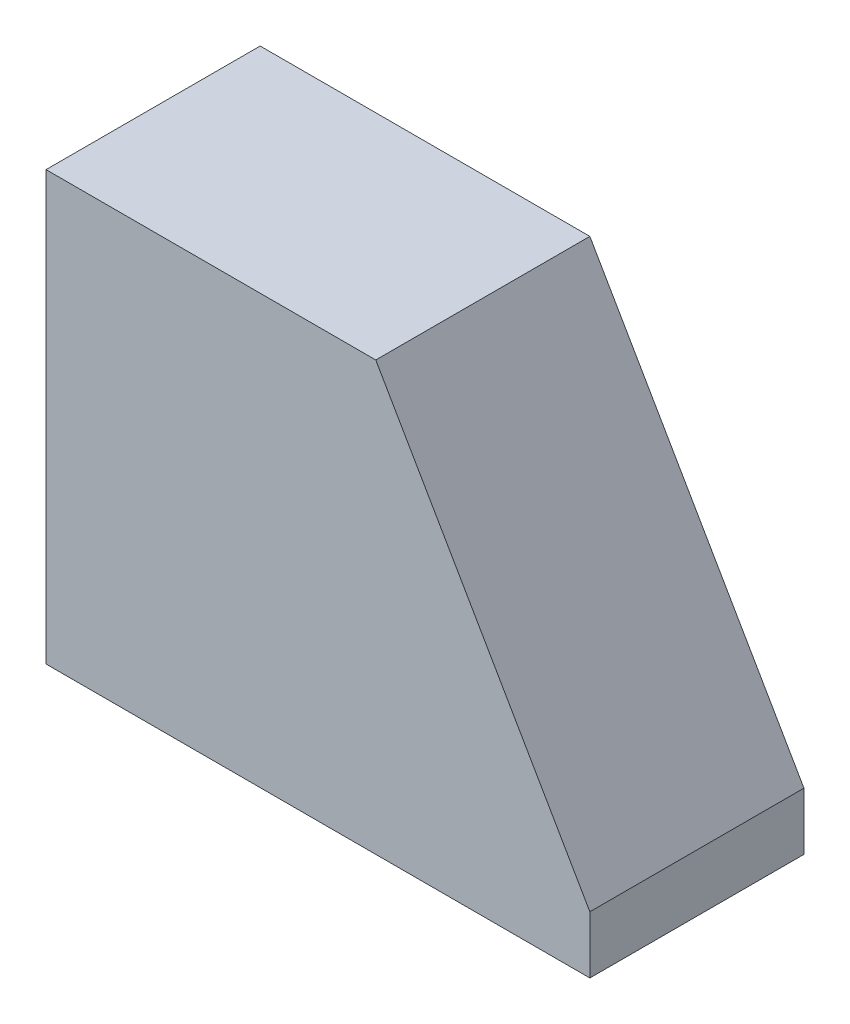
from build123d import *

# Parameters (mm, degrees)
SKETCH1_W           = 10
SKETCH1_H           = 20
BOSS_EXTRUDE1_DEPTH = 25.4
CHAMFER1_SIZE       = 10
CHAMFER1_SIZE2      = 17.320508076


with BuildPart() as part:
    # Sketch1 → Boss-Extrude1 (new body)
    with BuildSketch(Plane(origin=(0, 0, 0), x_dir=(0, 0, -1), z_dir=(1, 0, 0))):
        Rectangle(SKETCH1_W, SKETCH1_H)
    extrude(amount=BOSS_EXTRUDE1_DEPTH)

    # Chamfer1
    chamfer1_edges = [part.edges().sort_by_distance(p)[0] for p in [
        (25.4, 10, 0),
    ]]
    chamfer1_side = [part.faces().sort_by_distance(p)[0] for p in [
        (12.7, 10, 0),
    ]]
    chamfer(chamfer1_edges, length=CHAMFER1_SIZE, length2=CHAMFER1_SIZE2, reference=chamfer1_side[0])


solid = part.part
